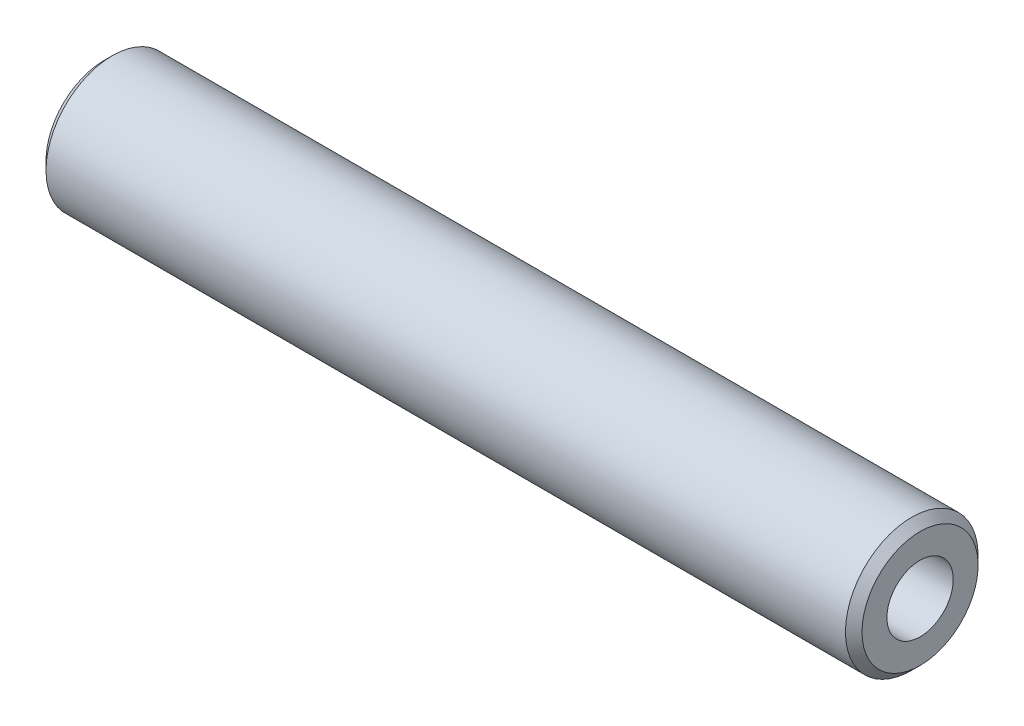
from build123d import *

# Parameters (mm, degrees)
SKETCH_1_W                     = 49.2
SKETCH_1_H                     = 4
M4X0_7_1_D                     = 3.3
M4X0_7_1_DEPTH                 = 11.5
M4X0_7_1_CBORE_D               = 4
M4X0_7_1_CBORE_DEPTH           = 8
M4X0_7_1_TIP                   = 0.991420021
M4X0_7_1_ON_FACE_2_D           = 3.3
M4X0_7_1_ON_FACE_2_DEPTH       = 11.5
M4X0_7_1_ON_FACE_2_CBORE_D     = 4
M4X0_7_1_ON_FACE_2_CBORE_DEPTH = 8
M4X0_7_1_ON_FACE_2_TIP         = 0.991420021
CHAMFER_1_SIZE                 = 0.5


with BuildPart() as part:
    # ｽｹｯﾁ1 → 回転1 (revolve)
    with BuildSketch(Plane.XY, mode=Mode.PRIVATE) as revolve_1_sk:
        with Locations((0, 2)):
            Rectangle(SKETCH_1_W, SKETCH_1_H)
    revolve(revolve_1_sk.sketch.rotate(Axis((0, 0, 0), (1, 0, 0)), 90), axis=Axis((0, 0, 0), (1, 0, 0)))

    # M4x0.7 ねじ穴1
    with Locations(Plane(origin=(24.6, 0, 0), x_dir=(0, 0, 1), z_dir=(1, 0, 0))):
        with Locations((0, 0)):
            CounterBoreHole(M4X0_7_1_D / 2, M4X0_7_1_CBORE_D / 2, M4X0_7_1_CBORE_DEPTH, depth=M4X0_7_1_DEPTH)
            with Locations((0, 0, -(M4X0_7_1_DEPTH + M4X0_7_1_TIP / 2))):  # 118° drill point
                Cone(0, M4X0_7_1_D / 2, M4X0_7_1_TIP, mode=Mode.SUBTRACT)

    # M4x0.7 ねじ穴1 on face 2
    with Locations(Plane(origin=(-24.6, 0, 0), x_dir=(0, 0, -1), z_dir=(-1, 0, 0))):
        with Locations((0, 0)):
            CounterBoreHole(M4X0_7_1_ON_FACE_2_D / 2, M4X0_7_1_ON_FACE_2_CBORE_D / 2, M4X0_7_1_ON_FACE_2_CBORE_DEPTH, depth=M4X0_7_1_ON_FACE_2_DEPTH)
            with Locations((0, 0, -(M4X0_7_1_ON_FACE_2_DEPTH + M4X0_7_1_ON_FACE_2_TIP / 2))):  # 118° drill point
                Cone(0, M4X0_7_1_ON_FACE_2_D / 2, M4X0_7_1_ON_FACE_2_TIP, mode=Mode.SUBTRACT)

    # 面取り1
    chamfer_1_edges = [part.edges().sort_by_distance(p)[0] for p in [
        (24.6, 0, -4),
        (-24.6, 0, -4),
    ]]
    chamfer(chamfer_1_edges, length=CHAMFER_1_SIZE)


solid = part.part
